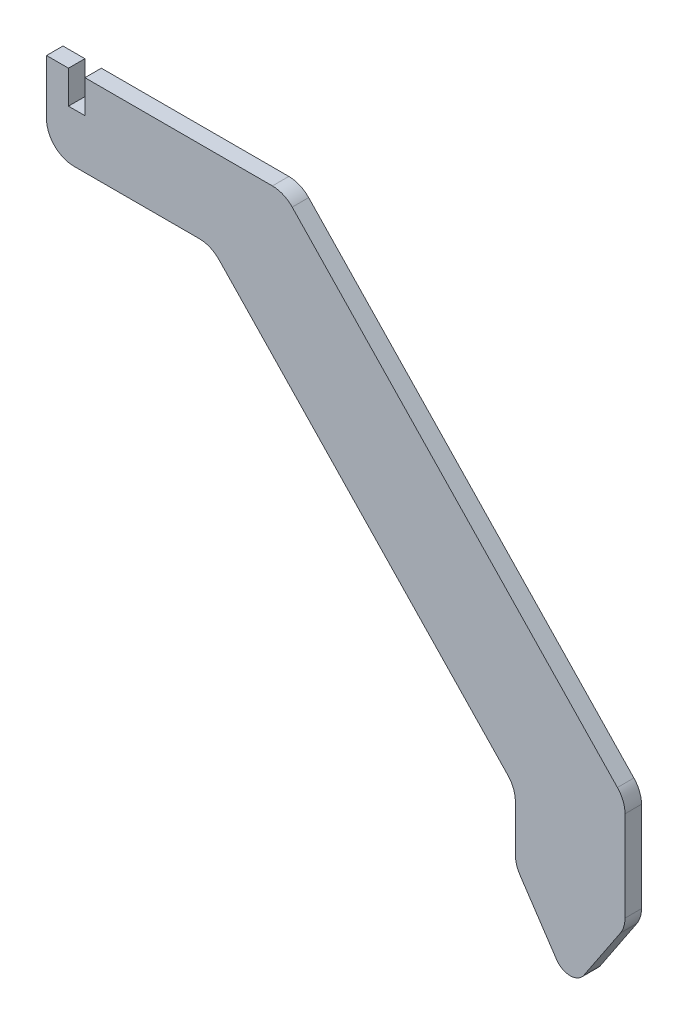
from build123d import *

# Parameters (mm, degrees)
BOSS_EXTRUDE1_DEPTH = 0.15
FILLET1_R           = 0.3
FILLET2_R           = 0.5


with BuildPart() as part:
    # Sketch1 → Boss-Extrude1 (new, symmetric)
    with BuildSketch(Plane.XY):
        Polygon((0, 0), (0.4, 0), (0.4, -0.6), (0.7, -0.6), (0.7, 0), (4.332844343, 0), (10.55, -6.5), (10.55, -8.5), (9.55, -10), (8.55, -8.5), (8.55, -7.302492649), (3, -1.5), (0, -1.5), align=None)
    extrude(amount=BOSS_EXTRUDE1_DEPTH, both=True)

    # Fillet1
    fillet1_edges = [part.edges().sort_by_distance(p)[0] for p in [
        (9.55, -10, 0),
    ]]
    fillet(fillet1_edges, radius=FILLET1_R)

    # Fillet2
    fillet2_edges = [part.edges().sort_by_distance(p)[0] for p in [
        (4.332844343, 0, 0),
        (10.55, -6.5, 0),
        (10.55, -8.5, 0),
        (8.55, -8.5, 0),
        (8.55, -7.302492649, 0),
        (3, -1.5, 0),
        (0, -1.5, 0),
    ]]
    fillet(fillet2_edges, radius=FILLET2_R)


solid = part.part
